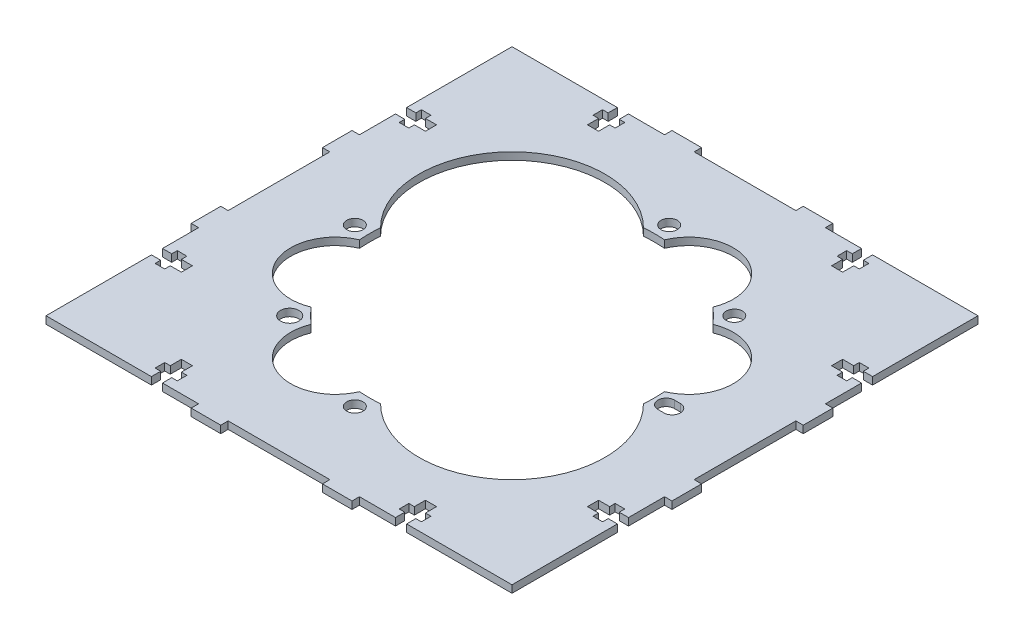
from build123d import *

# Parameters (mm, degrees)
SKETCH_1_R      = 2.2
SKETCH_1_R_2    = 2.5
EXTRUDE_1_DEPTH = 2


with BuildPart() as part:
    # 草图1 → 凸台-拉伸1 (new body)
    with BuildSketch(Plane(origin=(0, 0, 0), x_dir=(1, 0, 0), z_dir=(0, 1, 0))):
        Polygon((159.754738648, 48.995603023), (150.004738648, 48.995603023), (150.004738648, 46.495603023), (151.504738648, 46.495603023), (151.504738648, 43.895603023), (150.004738648, 43.895603023), (150.004738648, 40.895603023), (147.004738648, 40.895603023), (147.004738648, 43.895603023), (145.504738648, 43.895603023), (145.504738648, 46.495603023), (147.004738648, 46.495603023), (147.004738648, 48.995603023), (138.604738648, 48.995603023), (133.504738648, 48.995603023), (118.504738648, 48.995603023), (118.504738648, 33.995603023), (118.504738648, 21.495603023), (118.504738648, 20.495603023), (121.004738648, 20.495603023), (121.004738648, 21.995603023), (123.604738648, 21.995603023), (123.604738648, 20.495603023), (126.604738648, 20.495603023), (126.604738648, 17.495603023), (123.604738648, 17.495603023), (123.604738648, 15.995603023), (121.004738648, 15.995603023), (121.004738648, 17.495603023), (118.504738648, 17.495603023), (118.504738648, 7.745603023), (116.504738648, 7.745603023), (116.504738648, -0.254396977), (118.504738648, -0.254396977), (118.504738648, -27.754396977), (116.504738648, -27.754396977), (116.504738648, -35.754396977), (118.504738648, -35.754396977), (118.504738648, -45.504396977), (121.004738648, -45.504396977), (121.004738648, -44.004396977), (123.604738648, -44.004396977), (123.604738648, -45.504396977), (126.604738648, -45.504396977), (126.604738648, -48.504396977), (123.604738648, -48.504396977), (123.604738648, -50.004396977), (121.004738648, -50.004396977), (121.004738648, -48.504396977), (118.504738648, -48.504396977), (118.504738648, -56.904396977), (118.504738648, -62.004396977), (118.504738648, -77.004396977), (133.504738648, -77.004396977), (146.004738648, -77.004396977), (147.004738648, -77.004396977), (147.004738648, -74.504396977), (145.504738648, -74.504396977), (145.504738648, -71.904396977), (147.004738648, -71.904396977), (147.004738648, -68.904396977), (150.004738648, -68.904396977), (150.004738648, -71.904396977), (151.504738648, -71.904396977), (151.504738648, -74.504396977), (150.004738648, -74.504396977), (150.004738648, -77.004396977), (159.754738648, -77.004396977), (159.754738648, -79.004396977), (167.754738648, -79.004396977), (167.754738648, -77.004396977), (195.254738648, -77.004396977), (195.254738648, -79.004396977), (203.254738648, -79.004396977), (203.254738648, -77.004396977), (213.004738648, -77.004396977), (213.004738648, -74.504396977), (211.504738648, -74.504396977), (211.504738648, -71.904396977), (213.004738648, -71.904396977), (213.004738648, -68.904396977), (216.004738648, -68.904396977), (216.004738648, -71.904396977), (217.504738648, -71.904396977), (217.504738648, -74.504396977), (216.004738648, -74.504396977), (216.004738648, -77.004396977), (224.404738648, -77.004396977), (229.504738648, -77.004396977), (244.504738648, -77.004396977), (244.504738648, -62.004396977), (244.504738648, -49.504396977), (244.504738648, -48.504396977), (242.004738648, -48.504396977), (242.004738648, -50.004396977), (239.404738648, -50.004396977), (239.404738648, -48.504396977), (236.404738648, -48.504396977), (236.404738648, -45.504396977), (239.404738648, -45.504396977), (239.404738648, -44.004396977), (242.004738648, -44.004396977), (242.004738648, -45.504396977), (244.504738648, -45.504396977), (244.504738648, -35.754396977), (246.504738648, -35.754396977), (246.504738648, -27.754396977), (244.504738648, -27.754396977), (244.504738648, -0.254396977), (246.504738648, -0.254396977), (246.504738648, 7.745603023), (244.504738648, 7.745603023), (244.504738648, 17.495603023), (242.004738648, 17.495603023), (242.004738648, 15.995603023), (239.404738648, 15.995603023), (239.404738648, 17.495603023), (236.404738648, 17.495603023), (236.404738648, 20.495603023), (239.404738648, 20.495603023), (239.404738648, 21.995603023), (242.004738648, 21.995603023), (242.004738648, 20.495603023), (244.504738648, 20.495603023), (244.504738648, 28.895603023), (244.504738648, 33.995603023), (244.504738648, 48.995603023), (229.504738648, 48.995603023), (217.004738648, 48.995603023), (216.004738648, 48.995603023), (216.004738648, 46.495603023), (217.504738648, 46.495603023), (217.504738648, 43.895603023), (216.004738648, 43.895603023), (216.004738648, 40.895603023), (213.004738648, 40.895603023), (213.004738648, 43.895603023), (211.504738648, 43.895603023), (211.504738648, 46.495603023), (213.004738648, 46.495603023), (213.004738648, 48.995603023), (203.254738648, 48.995603023), (203.254738648, 50.995603023), (195.254738648, 50.995603023), (195.254738648, 48.995603023), (167.754738648, 48.995603023), (167.754738648, 50.995603023), (159.754738648, 50.995603023), align=None)
        with Locations(Location((181.504738648, -56.504396977, 0), (0, 0, 270))):
            Circle(SKETCH_1_R, mode=Mode.SUBTRACT)
        with Locations(Location((139.004738648, -14.004396977, 0), (0, 0, 270))):
            Circle(SKETCH_1_R, mode=Mode.SUBTRACT)
        with Locations(Location((211.556776849, 16.047641223, 0), (0, 0, 270))):
            Circle(SKETCH_1_R, mode=Mode.SUBTRACT)
        with Locations(Location((181.504738648, 28.49819903, 0), (0, 0, 270))):
            Circle(SKETCH_1_R, mode=Mode.SUBTRACT)
        with Locations(Location((151.452700448, -44.056435178, 0), (0, 0, 270))):
            Circle(SKETCH_1_R_2, mode=Mode.SUBTRACT)
        with BuildLine():
            Line((223.189738648, -11.79024286), (224.819738648, -11.79024286))
            ThreePointArc((224.819738648, -11.79024286), (227.033892766, -14.004396977), (224.819738648, -16.218551095))
            Line((224.819738648, -16.218551095), (223.189738648, -16.218551095))
            ThreePointArc((223.189738648, -16.218551095), (220.975584531, -14.004396977), (223.189738648, -11.79024286))
        make_face(mode=Mode.SUBTRACT)
        with BuildLine():
            ThreePointArc((156.373636186, -43.170776407), (154.281127573, -41.228008053), (152.338359218, -39.135499439))
            ThreePointArc((152.338359218, -39.135499439), (136.585624733, -32.610503171), (143.110621001, -16.857768685))
            ThreePointArc((143.110621001, -16.857768685), (143.004738648, -14.004396977), (143.110621001, -11.15102527))
            ThreePointArc((143.110621001, -11.15102527), (143.110621001, 24.38972067), (178.65136694, 24.38972067))
            ThreePointArc((178.65136694, 24.38972067), (181.504738648, 24.495603023), (184.358110356, 24.38972067))
            ThreePointArc((184.358110356, 24.38972067), (200.110844842, 30.914716938), (206.63584111, 15.161982452))
            ThreePointArc((206.63584111, 15.161982452), (208.728349724, 13.219214098), (210.671118078, 11.126705484))
            ThreePointArc((210.671118078, 11.126705484), (226.423852564, 4.601709216), (219.898856295, -11.15102527))
            ThreePointArc((219.898856295, -11.15102527), (220.004738648, -14.004396977), (219.898856295, -16.857768685))
            ThreePointArc((219.898856295, -16.857768685), (219.898856295, -52.398514625), (184.358110356, -52.398514625))
            ThreePointArc((184.358110356, -52.398514625), (181.504738648, -52.504396977), (178.65136694, -52.398514625))
            ThreePointArc((178.65136694, -52.398514625), (162.898632455, -58.923510893), (156.373636186, -43.170776407))
        make_face(mode=Mode.SUBTRACT)
    extrude(amount=EXTRUDE_1_DEPTH)


solid = part.part
